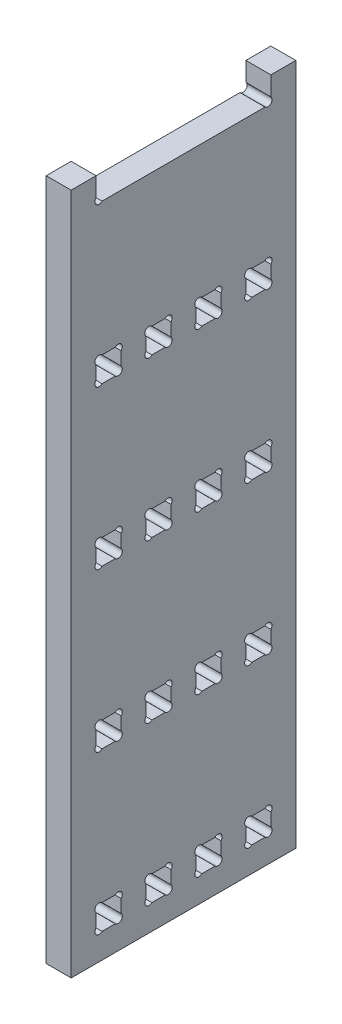
from build123d import *

# Parameters (mm, degrees)
SKETCH1_W               = 171.45
SKETCH1_H               = 742.95
BOSS_EXTRUDE1_DEPTH     = 19.05
CUT_EXTRUDE1_DEPTH      = 763.71404045
CUT_EXTRUDE1_DEPTH_BACK = 763.71404045
SKETCH5_W               = 124.369743878
SKETCH5_H               = 8.062305317
BOSS_EXTRUDE5_DEPTH     = 19.05
BOSS_EXTRUDE6_DEPTH     = 19.05


with BuildPart() as part:
    # Sketch1 → Boss-Extrude1 (new body)
    with BuildSketch(Plane(origin=(0, 0, 0), x_dir=(0, 0, -1), z_dir=(1, 0, 0))):
        with Locations((85.725, 371.475)):
            Rectangle(SKETCH1_W, SKETCH1_H)
        with BuildLine():
            Line((19.05, 33.609871939), (19.05, 23.540128061))
            ThreePointArc((19.05, 23.540128061), (19.05, 19.05), (23.540128061, 19.05))
            Line((23.540128061, 19.05), (33.609871939, 19.05))
            ThreePointArc((33.609871939, 19.05), (38.1, 19.05), (38.1, 23.540128061))
            Line((38.1, 23.540128061), (38.1, 33.609871939))
            ThreePointArc((38.1, 33.609871939), (38.1, 38.1), (33.609871939, 38.1))
            Line((33.609871939, 38.1), (23.540128061, 38.1))
            ThreePointArc((23.540128061, 38.1), (19.05, 38.1), (19.05, 33.609871939))
        make_face(mode=Mode.SUBTRACT)
        with BuildLine():
            Line((71.709871939, 38.1), (61.640128061, 38.1))
            ThreePointArc((61.640128061, 38.1), (57.15, 38.1), (57.15, 33.609871939))
            Line((57.15, 33.609871939), (57.15, 23.540128061))
            ThreePointArc((57.15, 23.540128061), (57.15, 19.05), (61.640128061, 19.05))
            Line((61.640128061, 19.05), (71.709871939, 19.05))
            ThreePointArc((71.709871939, 19.05), (76.2, 19.05), (76.2, 23.540128061))
            Line((76.2, 23.540128061), (76.2, 33.609871939))
            ThreePointArc((76.2, 33.609871939), (76.2, 38.1), (71.709871939, 38.1))
        make_face(mode=Mode.SUBTRACT)
        with BuildLine():
            Line((109.809871939, 38.1), (99.740128061, 38.1))
            ThreePointArc((99.740128061, 38.1), (95.25, 38.1), (95.25, 33.609871939))
            Line((95.25, 33.609871939), (95.25, 23.540128061))
            ThreePointArc((95.25, 23.540128061), (95.25, 19.05), (99.740128061, 19.05))
            Line((99.740128061, 19.05), (109.809871939, 19.05))
            ThreePointArc((109.809871939, 19.05), (114.3, 19.05), (114.3, 23.540128061))
            Line((114.3, 23.540128061), (114.3, 33.609871939))
            ThreePointArc((114.3, 33.609871939), (114.3, 38.1), (109.809871939, 38.1))
        make_face(mode=Mode.SUBTRACT)
        with BuildLine():
            Line((147.909871939, 38.1), (137.840128061, 38.1))
            ThreePointArc((137.840128061, 38.1), (133.35, 38.1), (133.35, 33.609871939))
            Line((133.35, 33.609871939), (133.35, 23.540128061))
            ThreePointArc((133.35, 23.540128061), (133.35, 19.05), (137.840128061, 19.05))
            Line((137.840128061, 19.05), (147.909871939, 19.05))
            ThreePointArc((147.909871939, 19.05), (152.4, 19.05), (152.4, 23.540128061))
            Line((152.4, 23.540128061), (152.4, 33.609871939))
            ThreePointArc((152.4, 33.609871939), (152.4, 38.1), (147.909871939, 38.1))
        make_face(mode=Mode.SUBTRACT)
        with BuildLine():
            Line((71.709871939, 158.75), (61.640128061, 158.75))
            ThreePointArc((61.640128061, 158.75), (57.15, 158.75), (57.15, 154.259871939))
            Line((57.15, 154.259871939), (57.15, 144.190128061))
            ThreePointArc((57.15, 144.190128061), (57.15, 139.7), (61.640128061, 139.7))
            Line((61.640128061, 139.7), (71.709871939, 139.7))
            ThreePointArc((71.709871939, 139.7), (76.2, 139.7), (76.2, 144.190128061))
            Line((76.2, 144.190128061), (76.2, 154.259871939))
            ThreePointArc((76.2, 154.259871939), (76.2, 158.75), (71.709871939, 158.75))
        make_face(mode=Mode.SUBTRACT)
        with BuildLine():
            Line((109.809871939, 158.75), (99.740128061, 158.75))
            ThreePointArc((99.740128061, 158.75), (95.25, 158.75), (95.25, 154.259871939))
            Line((95.25, 154.259871939), (95.25, 144.190128061))
            ThreePointArc((95.25, 144.190128061), (95.25, 139.7), (99.740128061, 139.7))
            Line((99.740128061, 139.7), (109.809871939, 139.7))
            ThreePointArc((109.809871939, 139.7), (114.3, 139.7), (114.3, 144.190128061))
            Line((114.3, 144.190128061), (114.3, 154.259871939))
            ThreePointArc((114.3, 154.259871939), (114.3, 158.75), (109.809871939, 158.75))
        make_face(mode=Mode.SUBTRACT)
        with BuildLine():
            Line((147.909871939, 158.75), (137.840128061, 158.75))
            ThreePointArc((137.840128061, 158.75), (133.35, 158.75), (133.35, 154.259871939))
            Line((133.35, 154.259871939), (133.35, 144.190128061))
            ThreePointArc((133.35, 144.190128061), (133.35, 139.7), (137.840128061, 139.7))
            Line((137.840128061, 139.7), (147.909871939, 139.7))
            ThreePointArc((147.909871939, 139.7), (152.4, 139.7), (152.4, 144.190128061))
            Line((152.4, 144.190128061), (152.4, 154.259871939))
            ThreePointArc((152.4, 154.259871939), (152.4, 158.75), (147.909871939, 158.75))
        make_face(mode=Mode.SUBTRACT)
        with BuildLine():
            Line((71.709871939, 279.4), (61.640128061, 279.4))
            ThreePointArc((61.640128061, 279.4), (57.15, 279.4), (57.15, 274.909871939))
            Line((57.15, 274.909871939), (57.15, 264.840128061))
            ThreePointArc((57.15, 264.840128061), (57.15, 260.35), (61.640128061, 260.35))
            Line((61.640128061, 260.35), (71.709871939, 260.35))
            ThreePointArc((71.709871939, 260.35), (76.2, 260.35), (76.2, 264.840128061))
            Line((76.2, 264.840128061), (76.2, 274.909871939))
            ThreePointArc((76.2, 274.909871939), (76.2, 279.4), (71.709871939, 279.4))
        make_face(mode=Mode.SUBTRACT)
        with BuildLine():
            Line((109.809871939, 279.4), (99.740128061, 279.4))
            ThreePointArc((99.740128061, 279.4), (95.25, 279.4), (95.25, 274.909871939))
            Line((95.25, 274.909871939), (95.25, 264.840128061))
            ThreePointArc((95.25, 264.840128061), (95.25, 260.35), (99.740128061, 260.35))
            Line((99.740128061, 260.35), (109.809871939, 260.35))
            ThreePointArc((109.809871939, 260.35), (114.3, 260.35), (114.3, 264.840128061))
            Line((114.3, 264.840128061), (114.3, 274.909871939))
            ThreePointArc((114.3, 274.909871939), (114.3, 279.4), (109.809871939, 279.4))
        make_face(mode=Mode.SUBTRACT)
        with BuildLine():
            Line((147.909871939, 279.4), (137.840128061, 279.4))
            ThreePointArc((137.840128061, 279.4), (133.35, 279.4), (133.35, 274.909871939))
            Line((133.35, 274.909871939), (133.35, 264.840128061))
            ThreePointArc((133.35, 264.840128061), (133.35, 260.35), (137.840128061, 260.35))
            Line((137.840128061, 260.35), (147.909871939, 260.35))
            ThreePointArc((147.909871939, 260.35), (152.4, 260.35), (152.4, 264.840128061))
            Line((152.4, 264.840128061), (152.4, 274.909871939))
            ThreePointArc((152.4, 274.909871939), (152.4, 279.4), (147.909871939, 279.4))
        make_face(mode=Mode.SUBTRACT)
        with BuildLine():
            Line((71.709871939, 400.05), (61.640128061, 400.05))
            ThreePointArc((61.640128061, 400.05), (57.15, 400.05), (57.15, 395.559871939))
            Line((57.15, 395.559871939), (57.15, 385.490128061))
            ThreePointArc((57.15, 385.490128061), (57.15, 381), (61.640128061, 381))
            Line((61.640128061, 381), (71.709871939, 381))
            ThreePointArc((71.709871939, 381), (76.2, 381), (76.2, 385.490128061))
            Line((76.2, 385.490128061), (76.2, 395.559871939))
            ThreePointArc((76.2, 395.559871939), (76.2, 400.05), (71.709871939, 400.05))
        make_face(mode=Mode.SUBTRACT)
        with BuildLine():
            Line((109.809871939, 400.05), (99.740128061, 400.05))
            ThreePointArc((99.740128061, 400.05), (95.25, 400.05), (95.25, 395.559871939))
            Line((95.25, 395.559871939), (95.25, 385.490128061))
            ThreePointArc((95.25, 385.490128061), (95.25, 381), (99.740128061, 381))
            Line((99.740128061, 381), (109.809871939, 381))
            ThreePointArc((109.809871939, 381), (114.3, 381), (114.3, 385.490128061))
            Line((114.3, 385.490128061), (114.3, 395.559871939))
            ThreePointArc((114.3, 395.559871939), (114.3, 400.05), (109.809871939, 400.05))
        make_face(mode=Mode.SUBTRACT)
        with BuildLine():
            Line((147.909871939, 400.05), (137.840128061, 400.05))
            ThreePointArc((137.840128061, 400.05), (133.35, 400.05), (133.35, 395.559871939))
            Line((133.35, 395.559871939), (133.35, 385.490128061))
            ThreePointArc((133.35, 385.490128061), (133.35, 381), (137.840128061, 381))
            Line((137.840128061, 381), (147.909871939, 381))
            ThreePointArc((147.909871939, 381), (152.4, 381), (152.4, 385.490128061))
            Line((152.4, 385.490128061), (152.4, 395.559871939))
            ThreePointArc((152.4, 395.559871939), (152.4, 400.05), (147.909871939, 400.05))
        make_face(mode=Mode.SUBTRACT)
        with BuildLine():
            Line((71.709871939, 520.7), (61.640128061, 520.7))
            ThreePointArc((61.640128061, 520.7), (57.15, 520.7), (57.15, 516.209871939))
            Line((57.15, 516.209871939), (57.15, 506.140128061))
            ThreePointArc((57.15, 506.140128061), (57.15, 501.65), (61.640128061, 501.65))
            Line((61.640128061, 501.65), (71.709871939, 501.65))
            ThreePointArc((71.709871939, 501.65), (76.2, 501.65), (76.2, 506.140128061))
            Line((76.2, 506.140128061), (76.2, 516.209871939))
            ThreePointArc((76.2, 516.209871939), (76.2, 520.7), (71.709871939, 520.7))
        make_face(mode=Mode.SUBTRACT)
        with BuildLine():
            Line((109.809871939, 520.7), (99.740128061, 520.7))
            ThreePointArc((99.740128061, 520.7), (95.25, 520.7), (95.25, 516.209871939))
            Line((95.25, 516.209871939), (95.25, 506.140128061))
            ThreePointArc((95.25, 506.140128061), (95.25, 501.65), (99.740128061, 501.65))
            Line((99.740128061, 501.65), (109.809871939, 501.65))
            ThreePointArc((109.809871939, 501.65), (114.3, 501.65), (114.3, 506.140128061))
            Line((114.3, 506.140128061), (114.3, 516.209871939))
            ThreePointArc((114.3, 516.209871939), (114.3, 520.7), (109.809871939, 520.7))
        make_face(mode=Mode.SUBTRACT)
        with BuildLine():
            Line((147.909871939, 520.7), (137.840128061, 520.7))
            ThreePointArc((137.840128061, 520.7), (133.35, 520.7), (133.35, 516.209871939))
            Line((133.35, 516.209871939), (133.35, 506.140128061))
            ThreePointArc((133.35, 506.140128061), (133.35, 501.65), (137.840128061, 501.65))
            Line((137.840128061, 501.65), (147.909871939, 501.65))
            ThreePointArc((147.909871939, 501.65), (152.4, 501.65), (152.4, 506.140128061))
            Line((152.4, 506.140128061), (152.4, 516.209871939))
            ThreePointArc((152.4, 516.209871939), (152.4, 520.7), (147.909871939, 520.7))
        make_face(mode=Mode.SUBTRACT)
        with BuildLine():
            Line((71.709871939, 641.35), (61.640128061, 641.35))
            ThreePointArc((61.640128061, 641.35), (57.15, 641.35), (57.15, 636.859871939))
            Line((57.15, 636.859871939), (57.15, 626.790128061))
            ThreePointArc((57.15, 626.790128061), (57.15, 622.3), (61.640128061, 622.3))
            Line((61.640128061, 622.3), (71.709871939, 622.3))
            ThreePointArc((71.709871939, 622.3), (76.2, 622.3), (76.2, 626.790128061))
            Line((76.2, 626.790128061), (76.2, 636.859871939))
            ThreePointArc((76.2, 636.859871939), (76.2, 641.35), (71.709871939, 641.35))
        make_face(mode=Mode.SUBTRACT)
        with BuildLine():
            Line((109.809871939, 641.35), (99.740128061, 641.35))
            ThreePointArc((99.740128061, 641.35), (95.25, 641.35), (95.25, 636.859871939))
            Line((95.25, 636.859871939), (95.25, 626.790128061))
            ThreePointArc((95.25, 626.790128061), (95.25, 622.3), (99.740128061, 622.3))
            Line((99.740128061, 622.3), (109.809871939, 622.3))
            ThreePointArc((109.809871939, 622.3), (114.3, 622.3), (114.3, 626.790128061))
            Line((114.3, 626.790128061), (114.3, 636.859871939))
            ThreePointArc((114.3, 636.859871939), (114.3, 641.35), (109.809871939, 641.35))
        make_face(mode=Mode.SUBTRACT)
        with BuildLine():
            Line((147.909871939, 641.35), (137.840128061, 641.35))
            ThreePointArc((137.840128061, 641.35), (133.35, 641.35), (133.35, 636.859871939))
            Line((133.35, 636.859871939), (133.35, 626.790128061))
            ThreePointArc((133.35, 626.790128061), (133.35, 622.3), (137.840128061, 622.3))
            Line((137.840128061, 622.3), (147.909871939, 622.3))
            ThreePointArc((147.909871939, 622.3), (152.4, 622.3), (152.4, 626.790128061))
            Line((152.4, 626.790128061), (152.4, 636.859871939))
            ThreePointArc((152.4, 636.859871939), (152.4, 641.35), (147.909871939, 641.35))
        make_face(mode=Mode.SUBTRACT)
        with BuildLine():
            Line((33.609871939, 158.75), (23.540128061, 158.75))
            ThreePointArc((23.540128061, 158.75), (19.05, 158.75), (19.05, 154.259871939))
            Line((19.05, 154.259871939), (19.05, 144.190128061))
            ThreePointArc((19.05, 144.190128061), (19.05, 139.7), (23.540128061, 139.7))
            Line((23.540128061, 139.7), (33.609871939, 139.7))
            ThreePointArc((33.609871939, 139.7), (38.1, 139.7), (38.1, 144.190128061))
            Line((38.1, 144.190128061), (38.1, 154.259871939))
            ThreePointArc((38.1, 154.259871939), (38.1, 158.75), (33.609871939, 158.75))
        make_face(mode=Mode.SUBTRACT)
        with BuildLine():
            Line((33.609871939, 279.4), (23.540128061, 279.4))
            ThreePointArc((23.540128061, 279.4), (19.05, 279.4), (19.05, 274.909871939))
            Line((19.05, 274.909871939), (19.05, 264.840128061))
            ThreePointArc((19.05, 264.840128061), (19.05, 260.35), (23.540128061, 260.35))
            Line((23.540128061, 260.35), (33.609871939, 260.35))
            ThreePointArc((33.609871939, 260.35), (38.1, 260.35), (38.1, 264.840128061))
            Line((38.1, 264.840128061), (38.1, 274.909871939))
            ThreePointArc((38.1, 274.909871939), (38.1, 279.4), (33.609871939, 279.4))
        make_face(mode=Mode.SUBTRACT)
        with BuildLine():
            Line((33.609871939, 400.05), (23.540128061, 400.05))
            ThreePointArc((23.540128061, 400.05), (19.05, 400.05), (19.05, 395.559871939))
            Line((19.05, 395.559871939), (19.05, 385.490128061))
            ThreePointArc((19.05, 385.490128061), (19.05, 381), (23.540128061, 381))
            Line((23.540128061, 381), (33.609871939, 381))
            ThreePointArc((33.609871939, 381), (38.1, 381), (38.1, 385.490128061))
            Line((38.1, 385.490128061), (38.1, 395.559871939))
            ThreePointArc((38.1, 395.559871939), (38.1, 400.05), (33.609871939, 400.05))
        make_face(mode=Mode.SUBTRACT)
        with BuildLine():
            Line((33.609871939, 520.7), (23.540128061, 520.7))
            ThreePointArc((23.540128061, 520.7), (19.05, 520.7), (19.05, 516.209871939))
            Line((19.05, 516.209871939), (19.05, 506.140128061))
            ThreePointArc((19.05, 506.140128061), (19.05, 501.65), (23.540128061, 501.65))
            Line((23.540128061, 501.65), (33.609871939, 501.65))
            ThreePointArc((33.609871939, 501.65), (38.1, 501.65), (38.1, 506.140128061))
            Line((38.1, 506.140128061), (38.1, 516.209871939))
            ThreePointArc((38.1, 516.209871939), (38.1, 520.7), (33.609871939, 520.7))
        make_face(mode=Mode.SUBTRACT)
        with BuildLine():
            Line((33.609871939, 641.35), (23.540128061, 641.35))
            ThreePointArc((23.540128061, 641.35), (19.05, 641.35), (19.05, 636.859871939))
            Line((19.05, 636.859871939), (19.05, 626.790128061))
            ThreePointArc((19.05, 626.790128061), (19.05, 622.3), (23.540128061, 622.3))
            Line((23.540128061, 622.3), (33.609871939, 622.3))
            ThreePointArc((33.609871939, 622.3), (38.1, 622.3), (38.1, 626.790128061))
            Line((38.1, 626.790128061), (38.1, 636.859871939))
            ThreePointArc((38.1, 636.859871939), (38.1, 641.35), (33.609871939, 641.35))
        make_face(mode=Mode.SUBTRACT)
    extrude(amount=BOSS_EXTRUDE1_DEPTH)

    # Sketch2 → Cut-Extrude1 (cut, two sides: drawn at the far end of the back side and taken through both)
    with BuildSketch(Plane.ZY.offset(-CUT_EXTRUDE1_DEPTH_BACK)):
        Polygon((-171.45, 520.7), (-171.45, 742.95), (0, 742.95), (0, 520.7), (-19.05, 520.7), (-19.05, 501.65), (-152.4, 501.65), (-152.4, 520.7), align=None)
    extrude(amount=CUT_EXTRUDE1_DEPTH + CUT_EXTRUDE1_DEPTH_BACK, mode=Mode.SUBTRACT)

    # Sketch5 → Boss-Extrude5 (add)
    with BuildSketch(Plane(origin=(19.05, 0, 0), x_dir=(0, 0, -1), z_dir=(1, 0, 0))):
        with Locations((85.725, 497.618847342)):
            Rectangle(SKETCH5_W, SKETCH5_H)
    extrude(amount=-BOSS_EXTRUDE5_DEPTH)

    # Sketch6 → Boss-Extrude6 (add)
    with BuildSketch(Plane(origin=(19.05, 0, 0), x_dir=(0, 0, -1), z_dir=(1, 0, 0))):
        Polygon((19.05, 516.209871939), (19.05, 506.140128061), (0, 520.7), (19.05, 520.7), align=None)
        Polygon((152.4, 506.140128061), (171.45, 520.7), (152.4, 520.7), align=None)
    extrude(amount=-BOSS_EXTRUDE6_DEPTH)


solid = part.part
